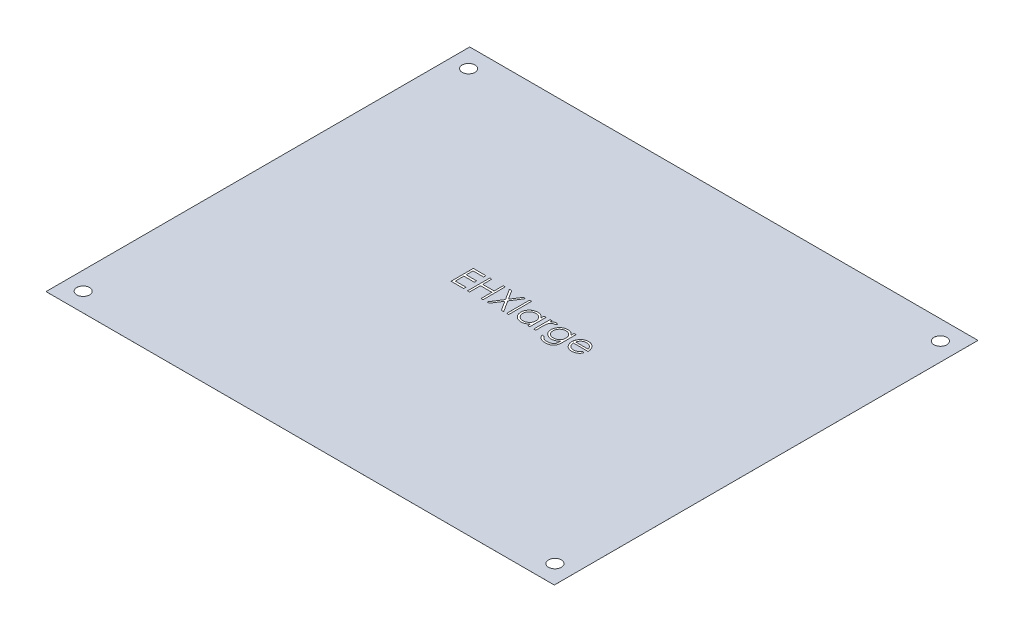
from build123d import *

# Parameters (mm, degrees)
SKETCH2_W           = 145.034
SKETCH2_H           = 120.904
BOSS_EXTRUDE1_DEPTH = 0.00254
SKETCH3_R           = 1.8288
CUT_EXTRUDE1_DEPTH  = 95.409531296
SKETCH5_W           = 0.569871795
SKETCH5_H           = 6.512820513
CUT_EXTRUDE2_DEPTH  = 2.54


with BuildPart() as part:
    # Sketch2 → Boss-Extrude1 (new body)
    with BuildSketch(Plane(origin=(0, 0, 0), x_dir=(1, 0, 0), z_dir=(0, 1, 0))):
        Rectangle(SKETCH2_W, SKETCH2_H)
    extrude(amount=BOSS_EXTRUDE1_DEPTH)

    # Sketch3 → Cut-Extrude1 (cut, through all)
    with BuildSketch(Plane(origin=(0, 0.00254, 0), x_dir=(1, 0, 0), z_dir=(0, 1, 0))):
        with Locations(Location((-67.31, 54.9275, 0), (0, 0, 270))):
            Circle(SKETCH3_R)
        with Locations(Location((67.31, 54.9275, 0), (0, 0, 270))):
            Circle(SKETCH3_R)
        with Locations(Location((67.31, -55.0545, 0), (0, 0, 270))):
            Circle(SKETCH3_R)
        with Locations(Location((-67.31, -55.0545, 0), (0, 0, 270))):
            Circle(SKETCH3_R)
    extrude(amount=-CUT_EXTRUDE1_DEPTH, mode=Mode.SUBTRACT)

    # Sketch5 → Cut-Extrude2 (cut)
    # profile 1 of 8: a face of its own
    with BuildSketch(Plane(origin=(0, 0.00254, 0), x_dir=(1, 0, 0), z_dir=(0, 1, 0))):
        Polygon((-17.28043017, 6.240856852), (-13.698378888, 6.240856852), (-13.698378888, 5.589574801), (-16.710558375, 5.589574801), (-16.710558375, 3.635728647), (-13.698378888, 3.635728647), (-13.698378888, 2.984446596), (-16.710558375, 2.984446596), (-16.710558375, 0.542138904), (-13.698378888, 0.542138904), (-13.698378888, -0.109143148), (-17.28043017, -0.109143148), align=None)
    # profile 2 of 8: a face of its own
    with BuildSketch(Plane(origin=(0, 0.00254, 0), x_dir=(1, 0, 0), z_dir=(0, 1, 0))):
        Polygon((-12.558635298, 6.240856852), (-11.988763503, 6.240856852), (-11.988763503, 3.635728647), (-8.732353247, 3.635728647), (-8.732353247, 6.240856852), (-8.162481452, 6.240856852), (-8.162481452, -0.109143148), (-8.732353247, -0.109143148), (-8.732353247, 2.984446596), (-11.988763503, 2.984446596), (-11.988763503, -0.109143148), (-12.558635298, -0.109143148), align=None)
    # profile 3 of 8: a face of its own
    with BuildSketch(Plane(origin=(0, 0.00254, 0), x_dir=(1, 0, 0), z_dir=(0, 1, 0))):
        Polygon((-6.982032734, 6.240856852), (-6.324390506, 6.240856852), (-4.661840426, 3.643360859), (-2.999290346, 6.240856852), (-2.341648118, 6.240856852), (-4.332383295, 3.129458615), (-2.260237862, -0.109143148), (-2.91788009, -0.109143148), (-4.661840426, 2.615556372), (-6.405800763, -0.109143148), (-7.06344299, -0.109143148), (-4.990025522, 3.129458615), align=None)
    # profile 4 of 8: a face of its own
    with BuildSketch(Plane(origin=(0, 0.00254, 0), x_dir=(1, 0, 0), z_dir=(0, 1, 0))):
        with Locations((-1.120494272, 3.147267108)):
            Rectangle(SKETCH5_W, SKETCH5_H)
    # profile 5 of 8: a face of its own
    with BuildSketch(Plane(origin=(0, 0.00254, 0), x_dir=(1, 0, 0), z_dir=(0, 1, 0))):
        with BuildLine():
            Line((5.188800599, 4.531241468), (5.188800599, -0.109143148))
            Line((5.188800599, -0.109143148), (4.618928805, -0.109143148))
            Line((4.618928805, -0.109143148), (4.618928805, 0.693511099))
            add(Edge.make_bspline(
                [(4.618928805, 0.693511099), (4.554668999, 0.620867836), (4.42926518, 0.479103594), (4.219822008, 0.293897367), (3.997811171, 0.140810983), (3.764310203, 0.017167565), (3.519529962, -0.075709452), (3.26401306, -0.14172434), (2.997655269, -0.184167441), (2.815768854, -0.188405652), (2.723596273, -0.190553404)],
                knots=[0, 0, 0, 0, 1.074387032, 2.096679803, 3.090159297, 4.057316773, 5.018401886, 5.985159533, 6.978961417, 8, 8, 8, 8], degree=3))
            add(Edge.make_bspline(
                [(2.723596273, -0.190553404), (2.641648699, -0.188328414), (2.480044456, -0.183940636), (2.242320273, -0.149900457), (2.013552906, -0.0952349), (1.793526182, -0.019214715), (1.583663861, 0.081624776), (1.382169114, 0.202349611), (1.190085801, 0.346115117), (1.010341723, 0.510467683), (0.844820808, 0.688984303), (0.699566785, 0.879385509), (0.578457626, 1.080847975), (0.477184051, 1.290820983), (0.399176398, 1.510920908), (0.344795661, 1.740386627), (0.310795136, 1.978946826), (0.306409172, 2.141397104), (0.304185215, 2.223769513)],
                knots=[0, 0, 0, 0, 1.033919861, 2.038935746, 3.024066025, 3.998881131, 4.97069526, 5.957263378, 6.95902576, 7.993208707, 9.027059324, 10.027763471, 11.009749337, 11.988697705, 12.965288445, 13.950418724, 14.960734635, 16, 16, 16, 16], degree=3))
            add(Edge.make_bspline(
                [(0.304185215, 2.223769513), (0.306458463, 2.304439375), (0.310952552, 2.463919341), (0.344431965, 2.698467836), (0.400731081, 2.924379537), (0.479739319, 3.140927134), (0.58105258, 3.348372654), (0.704293538, 3.546862813), (0.849471092, 3.736944434), (1.016843317, 3.914147946), (1.198153542, 4.077833918), (1.392116526, 4.220090329), (1.593907336, 4.34294804), (1.806655941, 4.440290776), (2.027213402, 4.519047294), (2.257543225, 4.573535679), (2.49668709, 4.605643676), (2.659048411, 4.610293262), (2.741404766, 4.612651724)],
                knots=[0, 0, 0, 0, 1.020392517, 2.01726096, 2.990465484, 3.961182959, 4.928053699, 5.906110375, 6.912531644, 7.948652711, 8.985773172, 9.998621852, 10.987621588, 11.969261332, 12.953316658, 13.946091881, 14.958173133, 16, 16, 16, 16], degree=3))
            add(Edge.make_bspline(
                [(2.741404766, 4.612651724), (2.836110225, 4.610043232), (3.021823159, 4.604928102), (3.293472548, 4.562360011), (3.5504561, 4.490444507), (3.794757568, 4.39262276), (4.025499669, 4.262631495), (4.240497941, 4.098656422), (4.442002461, 3.901731697), (4.558806704, 3.750473891), (4.618928805, 3.67261767)],
                knots=[0, 0, 0, 0, 1.038897134, 2.037228247, 3.008116434, 3.962042015, 4.918381754, 5.904844433, 6.921570401, 8, 8, 8, 8], degree=3))
            Line((4.618928805, 3.67261767), (4.618928805, 4.531241468))
            Line((4.618928805, 4.531241468), (5.188800599, 4.531241468))
        make_face()
        with BuildLine():
            add(Edge.make_bspline(
                [(2.749036978, 4.042779929), (2.66573525, 4.039816044), (2.50131089, 4.033965805), (2.259931058, 3.988293892), (2.02894815, 3.912303271), (1.809517415, 3.808377536), (1.605105079, 3.677696828), (1.422417991, 3.519633747), (1.259961947, 3.338500879), (1.123331239, 3.135115621), (1.011951337, 2.917078227), (0.933634008, 2.689159604), (0.881982659, 2.455470573), (0.876705772, 2.296969701), (0.87405701, 2.217409336)],
                knots=[0, 0, 0, 0, 1.031046209, 2.035121221, 3.029706178, 4.034933723, 5.034054252, 6.02443088, 7.017295772, 8.038157696, 9.050218397, 10.03989886, 11.016116709, 12, 12, 12, 12], degree=3))
            add(Edge.make_bspline(
                [(0.87405701, 2.217409336), (0.877440459, 2.138324428), (0.884194096, 1.980464596), (0.932727498, 1.746456978), (1.014152412, 1.518484645), (1.125263011, 1.298482557), (1.264394459, 1.094222832), (1.425663871, 0.909637181), (1.61063081, 0.750906071), (1.815513573, 0.618032187), (2.034330891, 0.510694471), (2.264443881, 0.436008239), (2.501526824, 0.387788551), (2.662730344, 0.382156143), (2.743948837, 0.379318391)],
                knots=[0, 0, 0, 0, 0.979072187, 1.954306742, 2.945804271, 3.96968567, 4.997920485, 5.998718438, 6.996577872, 8.005894225, 9.015743152, 10.005417472, 10.995077863, 12, 12, 12, 12], degree=3))
            add(Edge.make_bspline(
                [(2.743948837, 0.379318391), (2.826401777, 0.38233004), (2.990392499, 0.388319911), (3.23248844, 0.434187349), (3.467429301, 0.509967883), (3.692014701, 0.615013442), (3.901231111, 0.745201787), (4.089005831, 0.897614653), (4.247784803, 1.074876144), (4.382391394, 1.269687709), (4.487938222, 1.483250902), (4.564820501, 1.710642934), (4.610275444, 1.95187172), (4.616004468, 2.116724844), (4.618928805, 2.200872878)],
                knots=[0, 0, 0, 0, 1.01762866, 2.023962475, 3.030623092, 4.058876274, 5.077231937, 6.066672613, 7.034107872, 8.005628644, 8.981990164, 9.965428785, 10.961468474, 12, 12, 12, 12], degree=3))
            add(Edge.make_bspline(
                [(4.618928805, 2.200872878), (4.617187714, 2.264985799), (4.613760696, 2.391180317), (4.58757952, 2.576468813), (4.545932725, 2.753785716), (4.487247531, 2.923317452), (4.4101562, 3.084126694), (4.317178111, 3.237368087), (4.206678223, 3.382244628), (4.080435332, 3.516761343), (3.942249893, 3.639455067), (3.796028369, 3.748973047), (3.640038357, 3.838941249), (3.476903161, 3.913401841), (3.30633974, 3.97265487), (3.126960187, 4.012183972), (2.940671168, 4.039326269), (2.81358761, 4.041616588), (2.749036978, 4.042779929)],
                knots=[0, 0, 0, 0, 1.050140795, 2.067009409, 3.05949893, 4.030605086, 5.00011959, 5.97591094, 6.962425594, 7.979863591, 8.993523472, 9.986985069, 10.967611495, 11.937549037, 12.921786183, 13.919465291, 14.943216303, 16, 16, 16, 16], degree=3))
        make_face(mode=Mode.SUBTRACT)
    # profile 6 of 8: a face of its own
    with BuildSketch(Plane(origin=(0, 0.00254, 0), x_dir=(1, 0, 0), z_dir=(0, 1, 0))):
        with BuildLine():
            Line((6.328544189, 4.531241468), (6.898415984, 4.531241468))
            Line((6.898415984, 4.531241468), (6.898415984, 3.848158535))
            add(Edge.make_bspline(
                [(6.898415984, 3.848158535), (6.940487018, 3.911759824), (7.020947543, 4.033396794), (7.154683858, 4.19426824), (7.291668473, 4.32746411), (7.43255717, 4.433606209), (7.578386008, 4.513095724), (7.725954478, 4.571321659), (7.877584259, 4.605751931), (7.979478036, 4.610348712), (8.030527362, 4.612651724)],
                knots=[0, 0, 0, 0, 1.2804753, 2.448899062, 3.506932113, 4.484331642, 5.4025378, 6.288909075, 7.142734305, 8, 8, 8, 8], degree=3))
            add(Edge.make_bspline(
                [(8.030527362, 4.612651724), (8.070126555, 4.610491769), (8.151604466, 4.60604752), (8.274944308, 4.574822167), (8.402023142, 4.524969183), (8.48392433, 4.478087636), (8.526621112, 4.453647317)],
                knots=[0, 0, 0, 0, 0.901110191, 1.854092781, 2.881294221, 4, 4, 4, 4], degree=3))
            Line((8.526621112, 4.453647317), (8.213700439, 3.960097638))
            add(Edge.make_bspline(
                [(8.213700439, 3.960097638), (8.186288358, 3.972326406), (8.13425498, 3.99553895), (8.05813741, 4.023010883), (7.987958413, 4.039186901), (7.943247957, 4.041637489), (7.922404366, 4.042779929)],
                knots=[0, 0, 0, 0, 1.180555205, 2.24091978, 3.179933427, 4, 4, 4, 4], degree=3))
            add(Edge.make_bspline(
                [(7.922404366, 4.042779929), (7.876673963, 4.039731862), (7.783397199, 4.033514687), (7.64644675, 3.984639993), (7.513555391, 3.905672771), (7.408015375, 3.818095183), (7.326295859, 3.733644179), (7.267984307, 3.659896363), (7.214494181, 3.577203703), (7.163385352, 3.486979848), (7.116819361, 3.38768427), (7.073358747, 3.280309011), (7.034063382, 3.164729706), (7.01165651, 3.084207134), (7.000178805, 3.042960218)],
                knots=[0, 0, 0, 0, 1.125678352, 2.296057538, 3.5422874, 4.923748041, 5.663163013, 6.437101912, 7.23742474, 8.08941207, 8.991984279, 9.93940061, 10.944477711, 12, 12, 12, 12], degree=3))
            add(Edge.make_bspline(
                [(7.000178805, 3.042960218), (6.991592891, 3.006171631), (6.972575745, 2.924687708), (6.954085383, 2.787983956), (6.9358164, 2.626469604), (6.922941107, 2.439695071), (6.911006659, 2.22812678), (6.90427551, 1.991442421), (6.898645527, 1.729399056), (6.898494819, 1.546202729), (6.898415984, 1.450372077)],
                knots=[0, 0, 0, 0, 0.566838948, 1.255505196, 2.06880316, 3.007127437, 4.065329342, 5.249902469, 6.561414163, 8, 8, 8, 8], degree=3))
            Line((6.898415984, 1.450372077), (6.898415984, -0.109143148))
            Line((6.898415984, -0.109143148), (6.328544189, -0.109143148))
            Line((6.328544189, -0.109143148), (6.328544189, 4.531241468))
        make_face()
    # profile 7 of 8: a face of its own
    with BuildSketch(Plane(origin=(0, 0.00254, 0), x_dir=(1, 0, 0), z_dir=(0, 1, 0))):
        with BuildLine():
            Line((13.167005728, 4.531241468), (13.736877523, 4.531241468))
            Line((13.736877523, 4.531241468), (13.736877523, 0.848699401))
            add(Edge.make_bspline(
                [(13.736877523, 0.848699401), (13.736374888, 0.77025405), (13.735404683, 0.618835628), (13.728417921, 0.39989075), (13.713684692, 0.197659423), (13.696977513, 0.011219325), (13.672944185, -0.15856536), (13.643595633, -0.31220126), (13.610510901, -0.449835809), (13.581445649, -0.53460802), (13.567696833, -0.574708051)],
                knots=[0, 0, 0, 0, 1.307562039, 2.523909702, 3.650326591, 4.686913197, 5.643429486, 6.506965704, 7.293745905, 8, 8, 8, 8], degree=3))
            add(Edge.make_bspline(
                [(13.567696833, -0.574708051), (13.547396357, -0.626832338), (13.507402377, -0.729522428), (13.432498442, -0.87509041), (13.348616931, -1.012153146), (13.252810397, -1.139946807), (13.145512082, -1.257829863), (13.029249946, -1.368363404), (12.901759741, -1.469208965), (12.763114364, -1.558626576), (12.616509858, -1.639157374), (12.462030501, -1.708910432), (12.300547391, -1.769665134), (12.130543574, -1.815172492), (11.954684434, -1.854605485), (11.770901952, -1.880267986), (11.580269878, -1.89773422), (11.450647545, -1.899349357), (11.384884333, -1.900168789)],
                knots=[0, 0, 0, 0, 0.981931301, 1.934503488, 2.87077864, 3.801706999, 4.735015492, 5.667491629, 6.616593066, 7.585388521, 8.561939025, 9.551802639, 10.560317337, 11.588439944, 12.640189604, 13.723962949, 14.845264515, 16, 16, 16, 16], degree=3))
            add(Edge.make_bspline(
                [(11.384884333, -1.900168789), (11.288936315, -1.898614879), (11.101524056, -1.895579675), (10.82828357, -1.860217586), (10.568777721, -1.810226081), (10.326435492, -1.734560519), (10.102788316, -1.641964838), (9.899363571, -1.535656852), (9.717987419, -1.413756249), (9.554477326, -1.274962301), (9.406900441, -1.109928193), (9.268058072, -0.915438862), (9.134416078, -0.688531791), (9.056095835, -0.521993583), (9.015082651, -0.434784173)],
                knots=[0, 0, 0, 0, 1.157897085, 2.2616841, 3.32207898, 4.345638746, 5.321241055, 6.241986252, 7.112515963, 7.955008012, 8.825025602, 9.77857164, 10.836726669, 12, 12, 12, 12], degree=3))
            Line((9.015082651, -0.434784173), (9.584954446, -0.434784173))
            add(Edge.make_bspline(
                [(9.584954446, -0.434784173), (9.630787311, -0.507547691), (9.720384919, -0.649791407), (9.887931449, -0.833965276), (10.071548641, -0.991360666), (10.277433209, -1.118198785), (10.506441814, -1.213829406), (10.758712231, -1.28200173), (11.036297259, -1.322816385), (11.229551733, -1.327735448), (11.330186817, -1.330296994)],
                knots=[0, 0, 0, 0, 0.997731894, 1.950442991, 2.880492273, 3.800895997, 4.748200782, 5.754801363, 6.83083817, 8, 8, 8, 8], degree=3))
            add(Edge.make_bspline(
                [(11.330186817, -1.330296994), (11.429549604, -1.327702295), (11.621111111, -1.322699976), (11.896576232, -1.281983515), (12.148027048, -1.21381457), (12.374014841, -1.118367927), (12.571873164, -1.001436475), (12.742437777, -0.870807769), (12.880585975, -0.723522235), (12.973500929, -0.587846672), (13.031258021, -0.466971465), (13.06803765, -0.36291747), (13.097926138, -0.24525582), (13.1229267, -0.114380985), (13.143556786, 0.029894022), (13.156624872, 0.187899082), (13.166069702, 0.3592751), (13.166686504, 0.478098365), (13.167005728, 0.539594833)],
                knots=[0, 0, 0, 0, 1.570740765, 3.028230971, 4.391408896, 5.680370741, 6.894727393, 8.017376726, 9.065722033, 10.075533815, 10.603371122, 11.180248986, 11.817768598, 12.521299649, 13.286540596, 14.121245857, 15.027658897, 16, 16, 16, 16], degree=3))
            Line((13.167005728, 0.539594833), (13.167005728, 0.780009497))
            add(Edge.make_bspline(
                [(13.167005728, 0.780009497), (13.109164272, 0.711172227), (12.994498774, 0.574708514), (12.796474337, 0.395889545), (12.58018079, 0.241881851), (12.345986363, 0.115573757), (12.099627695, 0.014551744), (11.843773077, -0.056101914), (11.580716063, -0.101749161), (11.402458591, -0.106661006), (11.312378324, -0.109143148)],
                knots=[0, 0, 0, 0, 1.012485704, 2.007162095, 2.997754123, 3.998611389, 4.999708251, 5.992315798, 6.98544096, 8, 8, 8, 8], degree=3))
            add(Edge.make_bspline(
                [(11.312378324, -0.109143148), (11.259335378, -0.108208742), (11.153877195, -0.10635099), (10.997205011, -0.090097208), (10.842844787, -0.066513775), (10.691156525, -0.031894593), (10.541921341, 0.012540396), (10.395385852, 0.068087908), (10.250363597, 0.130889623), (10.109490665, 0.204863137), (9.974170114, 0.287163323), (9.845422621, 0.37631531), (9.723922557, 0.47185249), (9.610826355, 0.574716938), (9.506282365, 0.684759776), (9.40888449, 0.800807937), (9.320243303, 0.924481882), (9.238539868, 1.053526505), (9.167678313, 1.188801324), (9.105476667, 1.327373011), (9.051393889, 1.468945271), (9.00827666, 1.613992085), (8.975345355, 1.762422008), (8.950833943, 1.91399188), (8.936931195, 2.06916844), (8.934763262, 2.173710031), (8.933672394, 2.226313583)],
                knots=[0, 0, 0, 0, 1.028754217, 2.045334182, 3.052854819, 4.056607503, 5.061168794, 6.071104265, 7.095078842, 8.125279047, 9.155117945, 10.165957491, 11.161587969, 12.151493252, 13.128948131, 14.104219989, 15.088194871, 16.07871515, 17.064853787, 18.047899887, 19.02414258, 20.002704429, 20.980574569, 21.971845993, 22.979467364, 24, 24, 24, 24], degree=3))
            add(Edge.make_bspline(
                [(8.933672394, 2.226313583), (8.93461431, 2.278933486), (8.936494494, 2.383969487), (8.952734128, 2.539779229), (8.975899272, 2.693502633), (9.012561938, 2.843555204), (9.056689943, 2.991645825), (9.111342711, 3.136680653), (9.177053888, 3.278703863), (9.251457291, 3.417820627), (9.335067002, 3.552164157), (9.42674736, 3.679756786), (9.526609047, 3.799659612), (9.633274379, 3.913082263), (9.748045762, 4.018930401), (9.870863819, 4.116947123), (10.000517902, 4.208775428), (10.137409841, 4.292434568), (10.279427389, 4.366425215), (10.422962458, 4.433939498), (10.569916399, 4.487522829), (10.717549435, 4.534736166), (10.868461566, 4.568182878), (11.020802409, 4.593986088), (11.175093507, 4.609706367), (11.278422331, 4.611668672), (11.330186817, 4.612651724)],
                knots=[0, 0, 0, 0, 1.008818848, 2.013730394, 3.001654427, 3.987803273, 4.973046549, 5.963777569, 6.957074694, 7.972068341, 8.987420212, 9.989399531, 10.982630087, 11.977756091, 12.973280677, 13.973972381, 14.989194003, 16.018387222, 17.047741039, 18.059210846, 19.057554164, 20.045176975, 21.029480261, 22.018708529, 23.007435371, 24, 24, 24, 24], degree=3))
            add(Edge.make_bspline(
                [(11.330186817, 4.612651724), (11.415550664, 4.610190331), (11.584118031, 4.605329836), (11.832187136, 4.567191473), (12.071568057, 4.506387477), (12.303611599, 4.419273405), (12.530207995, 4.300346906), (12.750610427, 4.143696129), (12.96545657, 3.947915942), (13.098040634, 3.797778602), (13.167005728, 3.719682974)],
                knots=[0, 0, 0, 0, 0.96728863, 1.910097829, 2.838038873, 3.762875196, 4.71315279, 5.730631239, 6.819562287, 8, 8, 8, 8], degree=3))
            Line((13.167005728, 3.719682974), (13.167005728, 4.531241468))
        make_face()
        with BuildLine():
            add(Edge.make_bspline(
                [(11.375980087, 4.042779929), (11.292648667, 4.039947711), (11.127670125, 4.034340518), (10.88584699, 3.98647111), (10.652390267, 3.911457834), (10.431763276, 3.804156232), (10.225103234, 3.673356686), (10.041724631, 3.51489645), (9.881332855, 3.33392835), (9.745655238, 3.132088616), (9.637648331, 2.914333916), (9.561188127, 2.684807298), (9.511748799, 2.447217526), (9.506292059, 2.285070088), (9.503544189, 2.203416949)],
                knots=[0, 0, 0, 0, 1.026226791, 2.031711442, 3.026614839, 4.04107745, 5.047145931, 6.032893242, 7.017642609, 8.019221815, 9.021877557, 10.003543541, 10.994637589, 12, 12, 12, 12], degree=3))
            add(Edge.make_bspline(
                [(9.503544189, 2.203416949), (9.504860919, 2.141852297), (9.507450543, 2.020772631), (9.532349034, 1.843085307), (9.572591642, 1.673848167), (9.629627716, 1.513050973), (9.700299034, 1.359771417), (9.789185193, 1.215065377), (9.893780527, 1.078803981), (10.013266369, 0.951995059), (10.144940662, 0.836495873), (10.287759781, 0.735008285), (10.441530019, 0.652003406), (10.602469518, 0.580265029), (10.774483318, 0.527870148), (10.955093803, 0.487885506), (11.145578738, 0.465009618), (11.275430322, 0.462174256), (11.341635135, 0.460728647)],
                knots=[0, 0, 0, 0, 1.039728707, 2.044842319, 3.024901384, 3.974314358, 4.923051295, 5.871625912, 6.837440708, 7.820715446, 8.810779094, 9.792721783, 10.773906224, 11.758876063, 12.764959493, 13.806266761, 14.881525401, 16, 16, 16, 16], degree=3))
            add(Edge.make_bspline(
                [(11.341635135, 0.460728647), (11.408697953, 0.462121309), (11.539838584, 0.464844645), (11.731374426, 0.488255279), (11.912862398, 0.526032293), (12.08413609, 0.579668067), (12.24584218, 0.6481061), (12.396164123, 0.734713964), (12.538325108, 0.833346576), (12.667786022, 0.948394088), (12.784851294, 1.075185436), (12.886869971, 1.213152602), (12.973800471, 1.360219544), (13.045787101, 1.516369683), (13.100744, 1.682816523), (13.137608299, 1.859143969), (13.163383394, 2.044507252), (13.165779929, 2.171522884), (13.167005728, 2.236489865)],
                knots=[0, 0, 0, 0, 1.121943988, 2.193949579, 3.223793937, 4.220241907, 5.192961521, 6.155822191, 7.11847367, 8.083710714, 9.04790392, 10.001595906, 10.949595423, 11.902125208, 12.873731292, 13.87582262, 14.913508608, 16, 16, 16, 16], degree=3))
            add(Edge.make_bspline(
                [(13.167005728, 2.236489865), (13.164575368, 2.321067972), (13.1598273, 2.486303871), (13.1150196, 2.727071864), (13.042774361, 2.953437887), (12.941452396, 3.164686014), (12.814485038, 3.358577912), (12.661557355, 3.531522601), (12.485306699, 3.683742726), (12.286239461, 3.81055802), (12.072067667, 3.913002451), (11.847964926, 3.989858809), (11.614263945, 4.033391352), (11.455865174, 4.039632392), (11.375980087, 4.042779929)],
                knots=[0, 0, 0, 0, 1.070913519, 2.092188694, 3.091357305, 4.074328408, 5.051968682, 6.018948707, 6.99050112, 7.9935919, 9.000589572, 9.992915277, 10.987769056, 12, 12, 12, 12], degree=3))
        make_face(mode=Mode.SUBTRACT)
    # profile 8 of 8: a face of its own
    with BuildSketch(Plane(origin=(0, 0.00254, 0), x_dir=(1, 0, 0), z_dir=(0, 1, 0))):
        with BuildLine():
            Line((18.847915183, 1.356241468), (19.354185215, 1.090386099))
            add(Edge.make_bspline(
                [(19.354185215, 1.090386099), (19.313841678, 1.018824627), (19.235349131, 0.87959434), (19.100364917, 0.688310822), (18.958865014, 0.516229966), (18.8044621, 0.367949022), (18.641775683, 0.238678652), (18.469903581, 0.125580027), (18.287951011, 0.029207855), (18.095909368, -0.051986017), (17.892165896, -0.114414671), (17.67622686, -0.158509472), (17.447678575, -0.185765974), (17.291021934, -0.188932158), (17.210805808, -0.190553404)],
                knots=[0, 0, 0, 0, 1.120438281, 2.179929193, 3.190490725, 4.156257408, 5.095198341, 6.022838206, 6.959905092, 7.901321166, 8.864066838, 9.862729781, 10.905609505, 12, 12, 12, 12], degree=3))
            add(Edge.make_bspline(
                [(17.210805808, -0.190553404), (17.12164822, -0.1884721), (16.947727595, -0.184412079), (16.694562626, -0.149410037), (16.456202824, -0.092310186), (16.23266159, -0.012544132), (16.024486361, 0.091645442), (15.831263381, 0.21857193), (15.651976527, 0.367583306), (15.492275462, 0.539970282), (15.348504418, 0.724450405), (15.221639001, 0.916684652), (15.115580519, 1.11618936), (15.029306498, 1.321694453), (14.9596291, 1.53190466), (14.911066652, 1.748732609), (14.88307268, 1.971591454), (14.878782901, 2.122353763), (14.876621112, 2.198328808)],
                knots=[0, 0, 0, 0, 1.145258523, 2.234067595, 3.276747158, 4.290159414, 5.277019952, 6.260822364, 7.254936242, 8.264827045, 9.274100331, 10.257902744, 11.220704747, 12.172965371, 13.118907548, 14.062713208, 15.023725156, 16, 16, 16, 16], degree=3))
            add(Edge.make_bspline(
                [(14.876621112, 2.198328808), (14.878542697, 2.269620857), (14.882351025, 2.410912284), (14.906355454, 2.620036915), (14.948897357, 2.823288536), (15.007274402, 3.020836035), (15.082660234, 3.212348649), (15.174884403, 3.397942936), (15.284090574, 3.577421404), (15.368405282, 3.690638518), (15.41087592, 3.74766775)],
                knots=[0, 0, 0, 0, 1.024358464, 2.0301432, 3.019427413, 4.004406732, 4.986367066, 5.972626655, 6.978780325, 8, 8, 8, 8], degree=3))
            add(Edge.make_bspline(
                [(15.41087592, 3.74766775), (15.468402716, 3.8163727), (15.581634005, 3.951606201), (15.773143392, 4.129294307), (15.980516606, 4.278145156), (16.201154842, 4.401529532), (16.437622445, 4.495280291), (16.68674073, 4.565144047), (16.951346293, 4.604292725), (17.132240051, 4.609822366), (17.224798196, 4.612651724)],
                knots=[0, 0, 0, 0, 1.030682036, 2.02871468, 2.997146059, 3.962720338, 4.930598197, 5.918074684, 6.934738563, 8, 8, 8, 8], degree=3))
            add(Edge.make_bspline(
                [(17.224798196, 4.612651724), (17.319953137, 4.610195093), (17.50662544, 4.605375742), (17.778826574, 4.560696537), (18.036383874, 4.489844045), (18.279194275, 4.389779311), (18.507282393, 4.260675552), (18.719165655, 4.100761069), (18.918467685, 3.914945396), (19.034416106, 3.77204643), (19.093417987, 3.69933041)],
                knots=[0, 0, 0, 0, 1.056321875, 2.072262726, 3.055038591, 4.01806755, 4.982017516, 5.957941055, 6.960871419, 8, 8, 8, 8], degree=3))
            add(Edge.make_bspline(
                [(19.093417987, 3.69933041), (19.133562575, 3.644532484), (19.213584537, 3.535301383), (19.313818562, 3.357190855), (19.400826978, 3.170844491), (19.470373922, 2.973250095), (19.526688445, 2.766748856), (19.567431531, 2.549864525), (19.591324982, 2.322661686), (19.596021618, 2.167854936), (19.598415984, 2.088933776)],
                knots=[0, 0, 0, 0, 0.94817472, 1.890038105, 2.849395472, 3.817997239, 4.812318967, 5.836947057, 6.897266129, 8, 8, 8, 8], degree=3))
            Line((19.598415984, 2.088933776), (15.446492907, 2.088933776))
            add(Edge.make_bspline(
                [(15.446492907, 2.088933776), (15.449286193, 2.027791505), (15.454779077, 1.907557695), (15.48038798, 1.731624989), (15.520753612, 1.564033353), (15.577484626, 1.406039834), (15.646185902, 1.255580889), (15.730342846, 1.113772622), (15.830744608, 0.981260949), (15.942732662, 0.85686057), (16.067386964, 0.746078904), (16.19852852, 0.646924967), (16.338035416, 0.563820527), (16.484807653, 0.496365584), (16.638607892, 0.443558411), (16.799484589, 0.407512508), (16.967121171, 0.383369614), (17.081395289, 0.380685078), (17.139571833, 0.379318391)],
                knots=[0, 0, 0, 0, 1.094153842, 2.151609401, 3.174256925, 4.172055639, 5.149267565, 6.128595816, 7.11444997, 8.118368179, 9.117203808, 10.09244225, 11.054858984, 12.015122123, 12.976791628, 13.957293641, 14.960065497, 16, 16, 16, 16], degree=3))
            add(Edge.make_bspline(
                [(17.139571833, 0.379318391), (17.196451773, 0.380421579), (17.309312483, 0.382610517), (17.477389467, 0.403895555), (17.64274261, 0.438313055), (17.804687537, 0.485284895), (17.9599375, 0.542574326), (18.103711569, 0.611703797), (18.235937104, 0.68817548), (18.359520743, 0.775641605), (18.479392402, 0.882699315), (18.598305199, 1.016295552), (18.725807127, 1.17429721), (18.805616817, 1.293215775), (18.847915183, 1.356241468)],
                knots=[0, 0, 0, 0, 0.99110716, 1.966546729, 2.947904876, 3.932708344, 4.903319531, 5.828989031, 6.710028674, 7.56322171, 8.463672341, 9.504779593, 10.677557249, 12, 12, 12, 12], degree=3))
        make_face()
        with BuildLine():
            add(Edge.make_bspline(
                [(19.028544189, 2.65880557), (19.007686028, 2.734393927), (18.967540781, 2.879877181), (18.883654805, 3.081337083), (18.789182153, 3.260385132), (18.677382726, 3.415651037), (18.550711609, 3.553543125), (18.404398206, 3.674045415), (18.240321657, 3.781845648), (18.059330073, 3.872836611), (17.867665692, 3.950288212), (17.666994458, 4.002222351), (17.462238185, 4.037799663), (17.32374598, 4.041112746), (17.254055007, 4.042779929)],
                knots=[0, 0, 0, 0, 1.154881502, 2.222775134, 3.210006277, 4.132804581, 5.035138423, 5.962687519, 6.919655026, 7.923214229, 8.944639381, 9.960483929, 10.97369054, 12, 12, 12, 12], degree=3))
            add(Edge.make_bspline(
                [(17.254055007, 4.042779929), (17.197178168, 4.041670182), (17.084744616, 4.039476446), (16.919098393, 4.018666354), (16.760022367, 3.984267779), (16.606342774, 3.937159929), (16.460073484, 3.874370036), (16.318205833, 3.800740467), (16.184347115, 3.71085788), (16.100633621, 3.642352529), (16.058341866, 3.607743872)],
                knots=[0, 0, 0, 0, 1.04873581, 2.073130211, 3.073294108, 4.04793562, 5.032784715, 6.005352987, 6.992311501, 8, 8, 8, 8], degree=3))
            add(Edge.make_bspline(
                [(16.058341866, 3.607743872), (16.028055483, 3.58035847), (15.966763225, 3.524937093), (15.884865421, 3.429452675), (15.806451135, 3.326489127), (15.735088651, 3.212107258), (15.669633601, 3.087609559), (15.608383357, 2.954046135), (15.553253724, 2.810403456), (15.522236495, 2.710304887), (15.506278564, 2.65880557)],
                knots=[0, 0, 0, 0, 0.879870761, 1.780643979, 2.707998968, 3.669668524, 4.684282772, 5.740141944, 6.837334558, 8, 8, 8, 8], degree=3))
            Line((15.506278564, 2.65880557), (19.028544189, 2.65880557))
        make_face(mode=Mode.SUBTRACT)
    extrude(amount=-CUT_EXTRUDE2_DEPTH, mode=Mode.SUBTRACT)


with BuildPart() as cut_extrude2_piece_1:
    # of the separate pieces the step leaves, piece 1, a body of its own (cut_extrude2_pieces)
    add(part.part.solids().sort_by_distance((-72.517, 0, 60.452))[0])


with BuildPart() as cut_extrude2_piece_2:
    # of the separate pieces the step leaves, piece 2, a body of its own (cut_extrude2_pieces)
    add(part.part.solids().sort_by_distance((0.87405701, 0, -2.217409336))[0])


with BuildPart() as cut_extrude2_piece_3:
    # of the separate pieces the step leaves, piece 3, a body of its own (cut_extrude2_pieces)
    add(part.part.solids().sort_by_distance((9.503544189, 0, -2.203416949))[0])


with BuildPart() as cut_extrude2_piece_4:
    # of the separate pieces the step leaves, piece 4, a body of its own (cut_extrude2_pieces)
    add(part.part.solids().sort_by_distance((17.254055007, 0, -4.042779929))[0])


solid = Compound([cut_extrude2_piece_1.part, cut_extrude2_piece_2.part, cut_extrude2_piece_3.part, cut_extrude2_piece_4.part])
